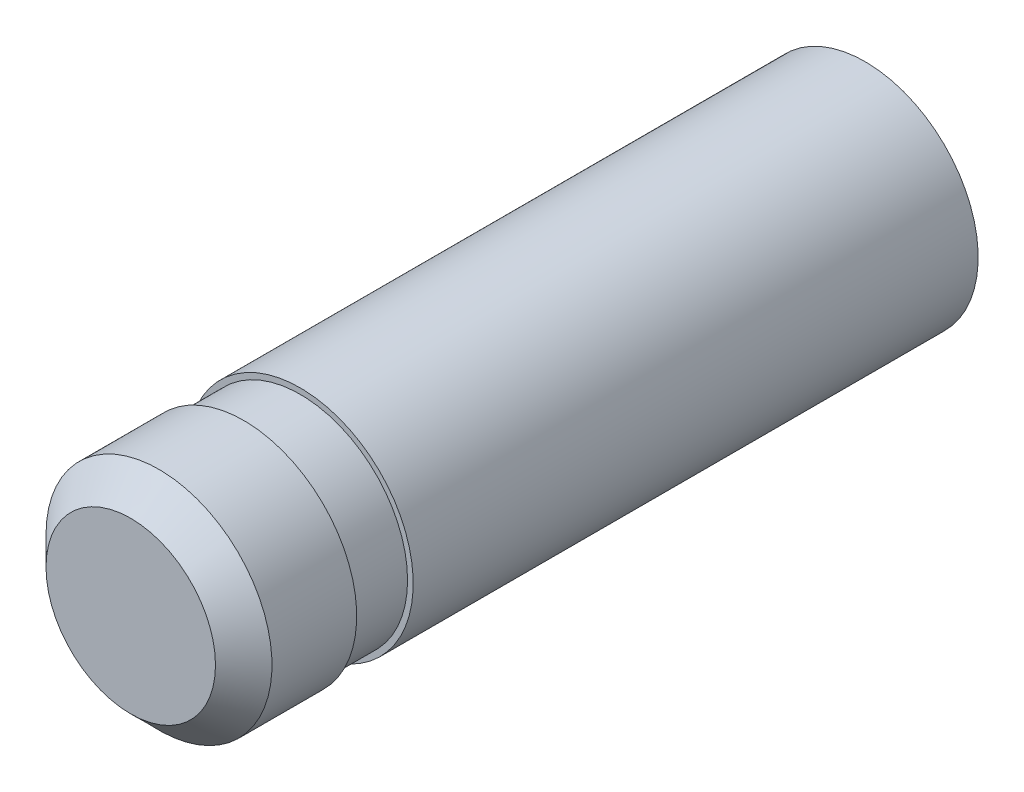
from build123d import *

# Parameters (mm, degrees)
SKETCH1_R           = 2
BOSS_EXTRUDE1_DEPTH = 13
CUT_EXTRUDE1_START  = -10
SKETCH2_OUTSIDE_W   = 8.836
SKETCH2_OUTSIDE_H   = 8.836
SKETCH2_OUTSIDE_R   = 1.9
CUT_EXTRUDE1_DEPTH  = 1
CHAMFER1_SIZE       = 0.5


with BuildPart() as part:
    # Sketch1 → Boss-Extrude1 (new body)
    with BuildSketch(Plane.XY):
        with Locations(Location((0, 0, 0), (0, 0, 180))):
            Circle(SKETCH1_R)
    extrude(amount=BOSS_EXTRUDE1_DEPTH)

    # Sketch2 outside → Cut-Extrude1 (cut)
    with BuildSketch(Plane(origin=(0, 0, 0), x_dir=(-1, 0, 0), z_dir=(0, 0, -1)).offset(CUT_EXTRUDE1_START)):
        Rectangle(SKETCH2_OUTSIDE_W, SKETCH2_OUTSIDE_H)
        Circle(SKETCH2_OUTSIDE_R, mode=Mode.SUBTRACT)
    extrude(amount=-CUT_EXTRUDE1_DEPTH, mode=Mode.SUBTRACT)

    # Chamfer1
    chamfer1_edges = [part.edges().sort_by_distance(p)[0] for p in [
        (2, 0, 13),
    ]]
    chamfer(chamfer1_edges, length=CHAMFER1_SIZE)


solid = part.part
